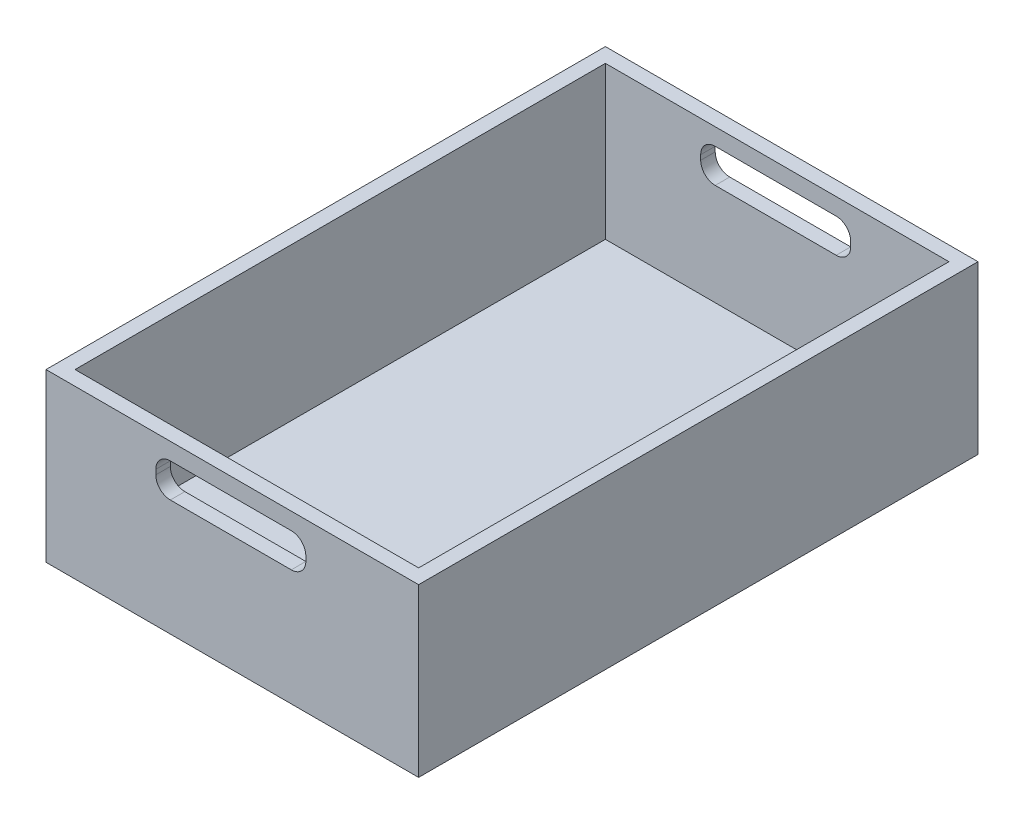
from build123d import *

# Parameters (mm, degrees)
SKETCH1_W               = 385
SKETCH1_H               = 578
BOSS_EXTRUDE1_DEPTH     = 15
SKETCH2_W               = 15
SKETCH2_H               = 578
BOSS_EXTRUDE2_DEPTH     = 157.5
SKETCH3_W               = 355
SKETCH3_H               = 15
BOSS_EXTRUDE3_DEPTH     = 157.5
CUT_EXTRUDE1_DEPTH      = 634.16388084
CUT_EXTRUDE1_DEPTH_BACK = 634.16388084


with BuildPart() as part:
    # Sketch1 → Boss-Extrude1 (new body)
    with BuildSketch(Plane(origin=(0, 0, 0), x_dir=(1, 0, 0), z_dir=(0, 1, 0))):
        Rectangle(SKETCH1_W, SKETCH1_H)
    extrude(amount=BOSS_EXTRUDE1_DEPTH)

    # Sketch2 → Boss-Extrude2 (add)
    with BuildSketch(Plane(origin=(0, 15, 0), x_dir=(1, 0, 0), z_dir=(0, 1, 0))):
        with Locations((185, 0)):
            Rectangle(SKETCH2_W, SKETCH2_H)
    boss_extrude2 = extrude(amount=BOSS_EXTRUDE2_DEPTH)

    # Mirror1: Boss-Extrude2 across plane
    add(boss_extrude2.mirror(Plane(origin=(0, 0, 0), x_dir=(0, 0, 1), z_dir=(1, 0, 0))))

    # Sketch3 → Boss-Extrude3 (add)
    with BuildSketch(Plane(origin=(0, 15, 0), x_dir=(1, 0, 0), z_dir=(0, 1, 0))):
        with Locations((0, -281.5)):
            Rectangle(SKETCH3_W, SKETCH3_H)
    boss_extrude3 = extrude(amount=BOSS_EXTRUDE3_DEPTH)

    # Mirror2: Boss-Extrude3 across plane
    add(boss_extrude3.mirror(Plane.XY))

    # Sketch4 → Cut-Extrude1 (cut, two sides: drawn at the far end of the back side and taken through both)
    with BuildSketch(Plane.XY.offset(289).offset(-CUT_EXTRUDE1_DEPTH_BACK)):
        with BuildLine():
            Line((-64.034446869, 155), (60.965553131, 155))
            ThreePointArc((60.965553131, 155), (71.572154849, 150.606601718), (75.965553131, 140))
            Line((75.965553131, 140), (75.965553131, 135))
            ThreePointArc((75.965553131, 135), (71.572154849, 124.393398282), (60.965553131, 120))
            Line((60.965553131, 120), (-64.034446869, 120))
            ThreePointArc((-64.034446869, 120), (-74.641048586, 124.393398282), (-79.034446869, 135))
            Line((-79.034446869, 135), (-79.034446869, 140))
            ThreePointArc((-79.034446869, 140), (-74.641048586, 150.606601718), (-64.034446869, 155))
        make_face()
    extrude(amount=CUT_EXTRUDE1_DEPTH + CUT_EXTRUDE1_DEPTH_BACK, mode=Mode.SUBTRACT)


solid = part.part
